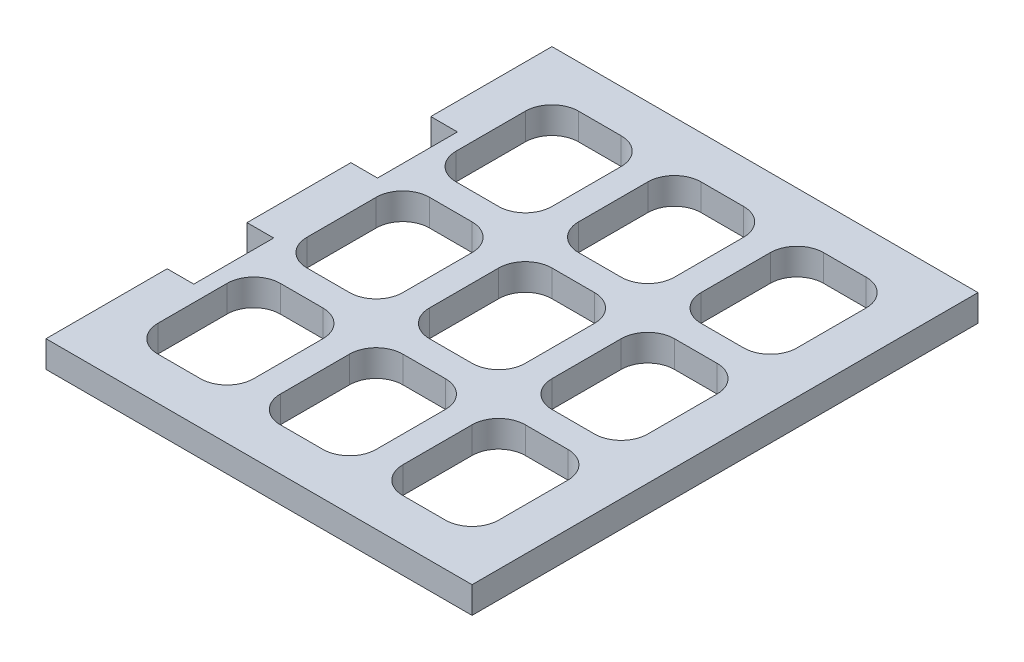
from build123d import *

# Parameters (mm, degrees)
SKETCH_1_W          = 80
SKETCH_1_H          = 95
EXTRUDE_1_DEPTH     = 5
CUT_EXTRUDE_2_DEPTH = 10
SKETCH_18_W         = 5
SKETCH_18_H         = 15
CUT_EXTRUDE_4_DEPTH = 10


with BuildPart() as part:
    # 스케치1 → 보스-돌출1 (new body)
    with BuildSketch(Plane(origin=(0, 0, 0), x_dir=(1, 0, 0), z_dir=(0, 1, 0))):
        Rectangle(SKETCH_1_W, SKETCH_1_H)
    extrude(amount=EXTRUDE_1_DEPTH)

    # 스케치9 → 컷-돌출2 (cut)
    with BuildSketch(Plane(origin=(0, 5, 0), x_dir=(1, 0, 0), z_dir=(0, 1, 0))):
        with BuildLine():
            Line((-27, 39.5), (-19, 39.5))
            ThreePointArc((-19, 39.5), (-15.464466094, 38.035533906), (-14, 34.5))
            Line((-14, 34.5), (-14, 21.5))
            ThreePointArc((-14, 21.5), (-15.464466094, 17.964466094), (-19, 16.5))
            Line((-19, 16.5), (-27, 16.5))
            ThreePointArc((-27, 16.5), (-30.535533906, 17.964466094), (-32, 21.5))
            Line((-32, 21.5), (-32, 34.5))
            ThreePointArc((-32, 34.5), (-30.535533906, 38.035533906), (-27, 39.5))
        make_face()
        with BuildLine():
            Line((14, 34.5), (14, 21.5))
            ThreePointArc((14, 21.5), (15.464466094, 17.964466094), (19, 16.5))
            Line((19, 16.5), (27, 16.5))
            ThreePointArc((27, 16.5), (30.535533906, 17.964466094), (32, 21.5))
            Line((32, 21.5), (32, 34.5))
            ThreePointArc((32, 34.5), (30.535533906, 38.035533906), (27, 39.5))
            Line((27, 39.5), (19, 39.5))
            ThreePointArc((19, 39.5), (15.464466094, 38.035533906), (14, 34.5))
        make_face()
        with BuildLine():
            Line((4, 39.5), (-4, 39.5))
            ThreePointArc((-4, 39.5), (-7.535533906, 38.035533906), (-9, 34.5))
            Line((-9, 34.5), (-9, 21.5))
            ThreePointArc((-9, 21.5), (-7.535533906, 17.964466094), (-4, 16.5))
            Line((-4, 16.5), (4, 16.5))
            ThreePointArc((4, 16.5), (7.535533906, 17.964466094), (9, 21.5))
            Line((9, 21.5), (9, 34.5))
            ThreePointArc((9, 34.5), (7.535533906, 38.035533906), (4, 39.5))
        make_face()
        with BuildLine():
            Line((-19, -16.5), (-27, -16.5))
            ThreePointArc((-27, -16.5), (-30.535533906, -17.964466094), (-32, -21.5))
            Line((-32, -21.5), (-32, -34.5))
            ThreePointArc((-32, -34.5), (-30.535533906, -38.035533906), (-27, -39.5))
            Line((-27, -39.5), (-19, -39.5))
            ThreePointArc((-19, -39.5), (-15.464466094, -38.035533906), (-14, -34.5))
            Line((-14, -34.5), (-14, -21.5))
            ThreePointArc((-14, -21.5), (-15.464466094, -17.964466094), (-19, -16.5))
        make_face()
        with BuildLine():
            Line((-19, 11.5), (-27, 11.5))
            ThreePointArc((-27, 11.5), (-30.535533906, 10.035533906), (-32, 6.5))
            Line((-32, 6.5), (-32, -6.5))
            ThreePointArc((-32, -6.5), (-30.535533906, -10.035533906), (-27, -11.5))
            Line((-27, -11.5), (-19, -11.5))
            ThreePointArc((-19, -11.5), (-15.464466094, -10.035533906), (-14, -6.5))
            Line((-14, -6.5), (-14, 6.5))
            ThreePointArc((-14, 6.5), (-15.464466094, 10.035533906), (-19, 11.5))
        make_face()
        with BuildLine():
            Line((-4, 11.5), (4, 11.5))
            ThreePointArc((4, 11.5), (7.535533906, 10.035533906), (9, 6.5))
            Line((9, 6.5), (9, -6.5))
            ThreePointArc((9, -6.5), (7.535533906, -10.035533906), (4, -11.5))
            Line((4, -11.5), (-4, -11.5))
            ThreePointArc((-4, -11.5), (-7.535533906, -10.035533906), (-9, -6.5))
            Line((-9, -6.5), (-9, 6.5))
            ThreePointArc((-9, 6.5), (-7.535533906, 10.035533906), (-4, 11.5))
        make_face()
        with BuildLine():
            Line((19, 11.5), (27, 11.5))
            ThreePointArc((27, 11.5), (30.535533906, 10.035533906), (32, 6.5))
            Line((32, 6.5), (32, -6.5))
            ThreePointArc((32, -6.5), (30.535533906, -10.035533906), (27, -11.5))
            Line((27, -11.5), (19, -11.5))
            ThreePointArc((19, -11.5), (15.464466094, -10.035533906), (14, -6.5))
            Line((14, -6.5), (14, 6.5))
            ThreePointArc((14, 6.5), (15.464466094, 10.035533906), (19, 11.5))
        make_face()
        with BuildLine():
            Line((-4, -16.5), (4, -16.5))
            ThreePointArc((4, -16.5), (7.535533906, -17.964466094), (9, -21.5))
            Line((9, -21.5), (9, -34.5))
            ThreePointArc((9, -34.5), (7.535533906, -38.035533906), (4, -39.5))
            Line((4, -39.5), (-4, -39.5))
            ThreePointArc((-4, -39.5), (-7.535533906, -38.035533906), (-9, -34.5))
            Line((-9, -34.5), (-9, -21.5))
            ThreePointArc((-9, -21.5), (-7.535533906, -17.964466094), (-4, -16.5))
        make_face()
        with BuildLine():
            Line((19, -16.5), (27, -16.5))
            ThreePointArc((27, -16.5), (30.535533906, -17.964466094), (32, -21.5))
            Line((32, -21.5), (32, -34.5))
            ThreePointArc((32, -34.5), (30.535533906, -38.035533906), (27, -39.5))
            Line((27, -39.5), (19, -39.5))
            ThreePointArc((19, -39.5), (15.464466094, -38.035533906), (14, -34.5))
            Line((14, -34.5), (14, -21.5))
            ThreePointArc((14, -21.5), (15.464466094, -17.964466094), (19, -16.5))
        make_face()
    extrude(amount=-CUT_EXTRUDE_2_DEPTH, mode=Mode.SUBTRACT)

    # 스케치18 → 컷-돌출4 (cut)
    with BuildSketch(Plane.XZ):
        with Locations((-37.5, -17.25)):
            Rectangle(SKETCH_18_W, SKETCH_18_H)
        with Locations((-37.5, 17.25)):
            Rectangle(SKETCH_18_W, SKETCH_18_H)
    extrude(amount=-CUT_EXTRUDE_4_DEPTH, mode=Mode.SUBTRACT)


solid = part.part
